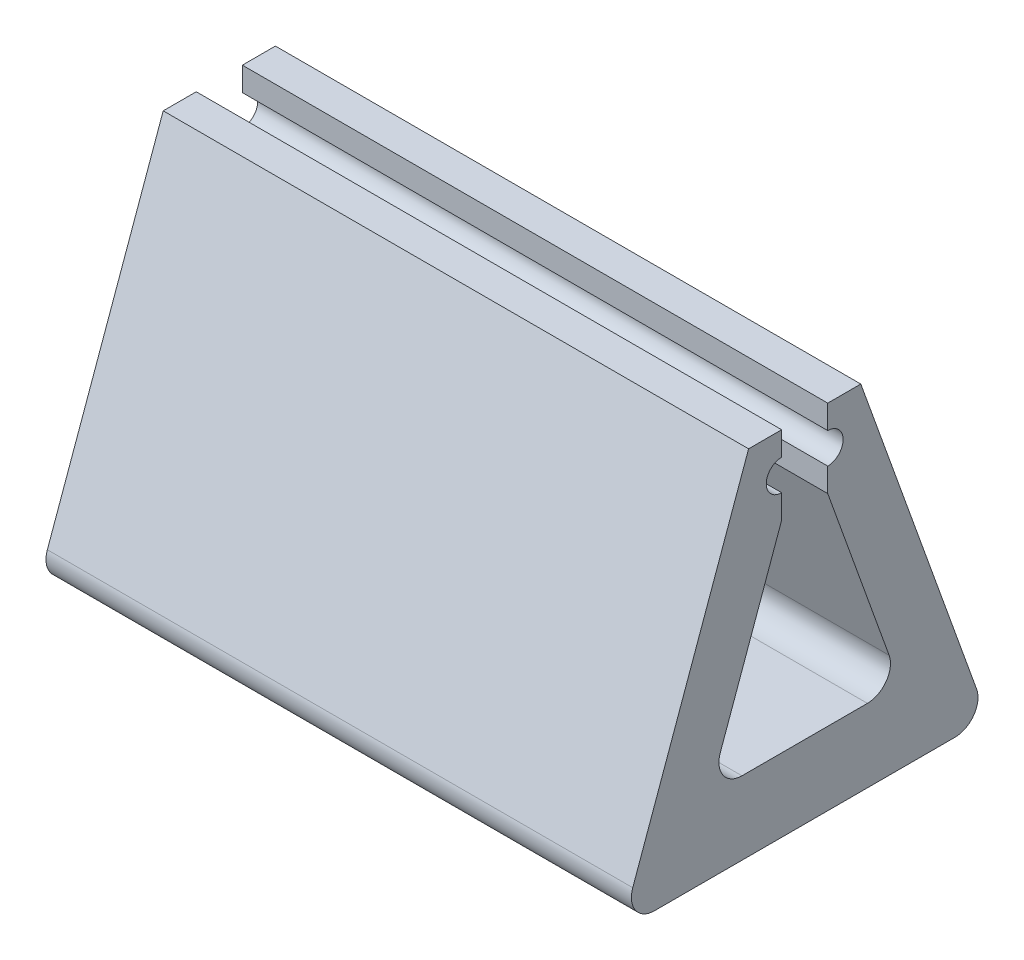
from build123d import *

# Parameters (mm, degrees)
BOSS_EXTRUDE1_DEPTH = 15.24


with BuildPart() as part:
    # Sketch1 → Boss-Extrude1 (new body)
    with BuildSketch(Plane(origin=(0, 0, 0), x_dir=(0, 0, -1), z_dir=(1, 0, 0))):
        with BuildLine():
            Line((-0.6, 6.665999974), (-0.6, 7.285861192))
            Line((-0.6, 7.285861192), (-1.46058835, 7.285861192))
            Line((-1.46058835, 7.285861192), (-4.476578637, -1.101757214))
            ThreePointArc((-4.476578637, -1.101757214), (-4.402791775, -1.649877187), (-3.911970022, -1.904777192))
            Line((-3.911970022, -1.904777192), (3.911970022, -1.904777192))
            ThreePointArc((3.911970022, -1.904777192), (4.402791775, -1.649877187), (4.476578637, -1.101757214))
            Line((4.476578637, -1.101757214), (1.46058835, 7.285861192))
            Line((1.46058835, 7.285861192), (0.6, 7.285861192))
            Line((0.6, 7.285861192), (0.6, 6.665999974))
            ThreePointArc((0.6, 6.665999974), (1, 6.265999974), (0.6, 5.865999974))
            Line((0.6, 5.865999974), (0.6, 5.246138756))
            Line((0.6, 5.246138756), (2.197641003, 0.803019978))
            ThreePointArc((2.197641003, 0.803019978), (2.12385414, 0.254900005), (1.633032387, 0))
            Line((1.633032387, 0), (0, 0))
            Line((0, 0), (-1.633032387, 0))
            ThreePointArc((-1.633032387, 0), (-2.12385414, 0.254900005), (-2.197641003, 0.803019978))
            Line((-2.197641003, 0.803019978), (-0.6, 5.246138756))
            Line((-0.6, 5.246138756), (-0.6, 5.865999974))
            ThreePointArc((-0.6, 5.865999974), (-1, 6.265999974), (-0.6, 6.665999974))
        make_face()
    extrude(amount=BOSS_EXTRUDE1_DEPTH)


solid = part.part
